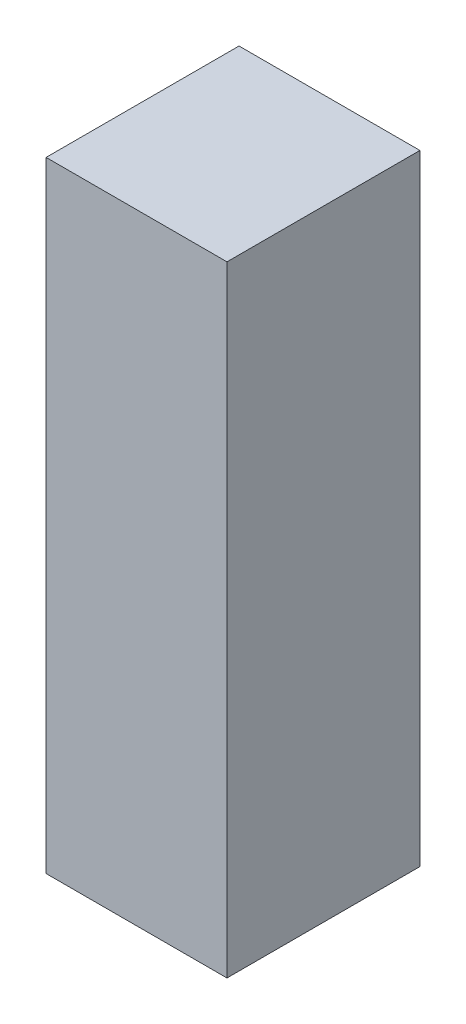
from build123d import *

# Parameters (mm, degrees)
SKETCH1_W           = 30
SKETCH1_H           = 32
BOSS_EXTRUDE1_DEPTH = 102.87


with BuildPart() as part:
    # Sketch1 → Boss-Extrude1 (new body)
    with BuildSketch(Plane(origin=(0, 0, 0), x_dir=(1, 0, 0), z_dir=(0, 1, 0))):
        Rectangle(SKETCH1_W, SKETCH1_H)
    extrude(amount=BOSS_EXTRUDE1_DEPTH)


solid = part.part
